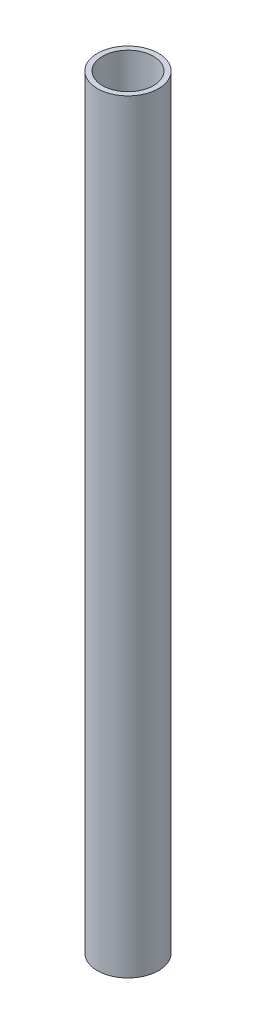
from build123d import *

# Parameters (mm, degrees)
SKETCH_1_R      = 6
SKETCH_1_R_2    = 5
EXTRUDE_1_DEPTH = 150


with BuildPart() as part:
    # 草图1 → 凸台-拉伸1 (new body)
    with BuildSketch(Plane(origin=(0, 0, 0), x_dir=(1, 0, 0), z_dir=(0, 1, 0))):
        with Locations(Location((0, 0, 0), (0, 0, 270))):
            Circle(SKETCH_1_R)
        with Locations(Location((0, 0, 0), (0, 0, 270))):
            Circle(SKETCH_1_R_2, mode=Mode.SUBTRACT)
    extrude(amount=EXTRUDE_1_DEPTH)


solid = part.part
